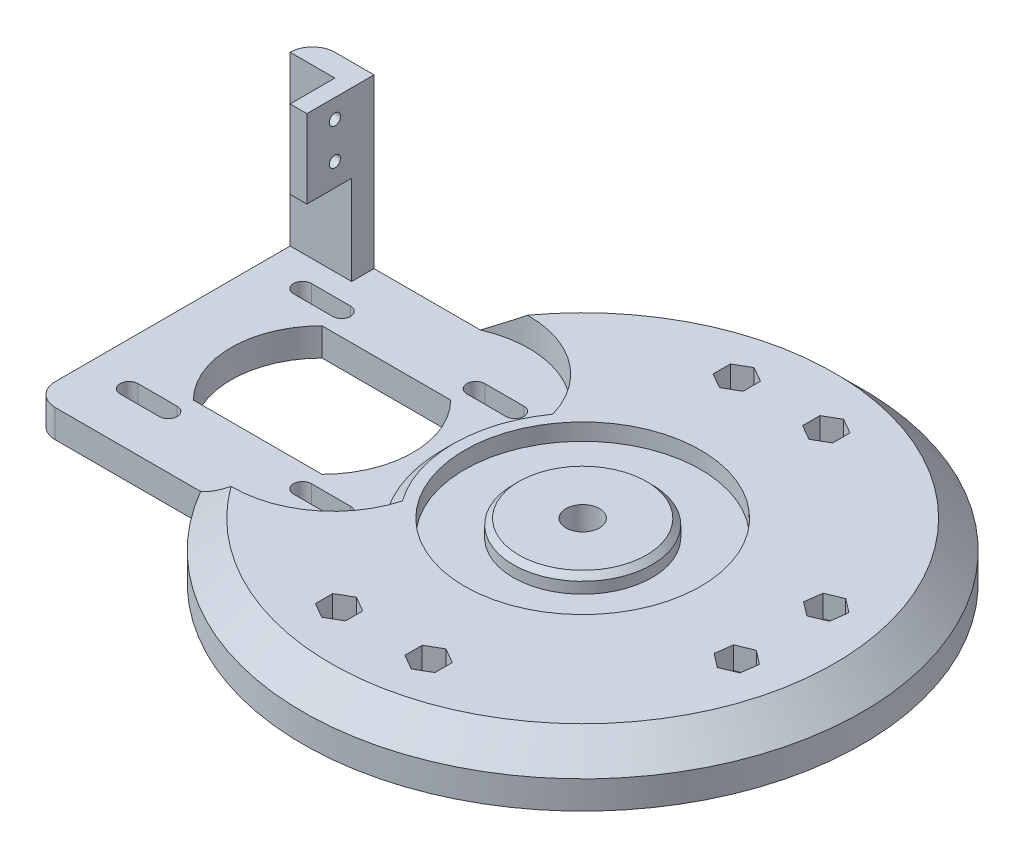
from build123d import *

# Parameters (mm, degrees)
SKETCH1_R            = 50
BOSS_EXTRUDE1_DEPTH  = 5
SKETCH2_R            = 25.1
SKETCH2_R_2          = 21.1
SKETCH2_R_3          = 12.4
SKETCH2_R_4          = 9.399999999999999
BOSS_EXTRUDE2_DEPTH  = 5
CHAMFER1_SIZE        = 1
CUT_EXTRUDE1_START   = -5
SKETCH3_R            = 9.399999999999997
CUT_EXTRUDE1_DEPTH   = 5
CUT_EXTRUDE2_DEPTH   = 5
BOSS_EXTRUDE3_DEPTH  = 5
SKETCH6_R            = 1.5000000000000009
SKETCH6_R_2          = 1.5000000000000018
SKETCH6_R_3          = 1.500000000000004
SKETCH6_R_4          = 1.5000000000000042
CUT_EXTRUDE3_DEPTH   = 10
CUT_EXTRUDE4_DEPTH   = 4
CHAMFER4_SIZE        = 2
SKETCH10_R           = 21.638560794932243
SKETCH10_R_2         = 12.399999999999999
BOSS_EXTRUDE4_DEPTH  = 2
CHAMFER5_SIZE        = 5
SKETCH14_R           = 9.399999999999995
SKETCH14_R_2         = 3
BOSS_EXTRUDE6_DEPTH  = 10
SKETCH16_R           = 9.4
CUT_EXTRUDE8_DEPTH   = 4
FILLET3_R            = 4
BOSS_EXTRUDE7_START  = 30
BOSS_EXTRUDE7_DEPTH  = 30
SKETCH22_W           = 12
SKETCH22_H           = 13.999999999999996
BOSS_EXTRUDE10_DEPTH = 3
SKETCH23_R           = 1.0000000000000018
CUT_EXTRUDE11_DEPTH  = 3
BOSS_EXTRUDE11_DEPTH = 4


with BuildPart() as part:
    # Sketch1 → Boss-Extrude1 (new body)
    with BuildSketch(Plane(origin=(0, 0, 0), x_dir=(1, 0, 0), z_dir=(0, 1, 0))):
        with BuildLine():
            ThreePointArc((-43.30127018922194, -24.999999999999986), (-50, 6.12e-15), (-43.30127018922194, 24.999999999999996))
            Line((-43.301270189221945, 24.99999999999999), (-73.30127018922194, 25.000000000000004))
            Line((-73.30127018922194, 25.000000000000004), (-73.30127018922195, -24.999999999999996))
            Line((-73.30127018922195, -24.999999999999996), (-43.30127018922194, -24.99999999999999))
        make_face()
        Circle(SKETCH1_R)
    extrude(amount=BOSS_EXTRUDE1_DEPTH)

    # Sketch2 → Boss-Extrude2 (add)
    # profile 1 of 2: a face of its own
    with BuildSketch(Plane(origin=(0, 5, 0), x_dir=(1, 0, 0), z_dir=(0, 1, 0))):
        with Locations(Location((0, 0, 0), (0, 0, 270))):
            Circle(SKETCH2_R)
        with Locations(Location((0, 0, 0), (0, 0, 270))):
            Circle(SKETCH2_R_2, mode=Mode.SUBTRACT)
    # profile 2 of 2: a face of its own
    with BuildSketch(Plane(origin=(0, 5, 0), x_dir=(1, 0, 0), z_dir=(0, 1, 0))):
        with Locations(Location((0, 0, 0), (0, 0, 270))):
            Circle(SKETCH2_R_3)
        with Locations(Location((0, 0, 0), (0, 0, 270))):
            Circle(SKETCH2_R_4, mode=Mode.SUBTRACT)
    extrude(amount=BOSS_EXTRUDE2_DEPTH)

    # Chamfer1
    chamfer1_edges = [part.edges().sort_by_distance(p)[0] for p in [
        (3.8e-15, 10, -12.4),
    ]]
    chamfer(chamfer1_edges, length=CHAMFER1_SIZE)

    # Sketch3 → Cut-Extrude1 (cut)
    with BuildSketch(Plane(origin=(0, 5, 0), x_dir=(1, 0, 0), z_dir=(0, 1, 0)).offset(CUT_EXTRUDE1_START)):
        with Locations(Location((0, 0, 0), (0, 0, 270))):
            Circle(SKETCH3_R)
    extrude(amount=CUT_EXTRUDE1_DEPTH, mode=Mode.SUBTRACT)

    # Sketch4 → Cut-Extrude2 (cut)
    with BuildSketch(Plane(origin=(0, 5, 0), x_dir=(1, 0, 0), z_dir=(0, 1, 0))):
        with BuildLine():
            Line((-65.60000000000008, 17.09999999999999), (-58.60000000000002, 17.099999999999994))
            ThreePointArc((-58.60000000000002, 17.099999999999994), (-57.000000000000014, 15.499999999999982), (-58.60000000000005, 13.899999999999999))
            Line((-58.60000000000005, 13.899999999999999), (-65.60000000000005, 13.899999999999995))
            ThreePointArc((-65.60000000000005, 13.899999999999995), (-67.20000000000007, 15.49999999999998), (-65.60000000000008, 17.09999999999999))
        make_face()
        with BuildLine():
            Line((-34.600000000000044, 17.099999999999998), (-27.599999999999948, 17.099999999999998))
            ThreePointArc((-27.599999999999948, 17.099999999999998), (-25.999999999999968, 15.499999999999998), (-27.59999999999995, 13.899999999999999))
            Line((-27.59999999999995, 13.899999999999999), (-34.600000000000044, 13.899999999999999))
            ThreePointArc((-34.600000000000044, 13.899999999999999), (-36.20000000000004, 15.499999999999998), (-34.600000000000044, 17.099999999999998))
        make_face()
        with BuildLine():
            Line((-34.600000000000044, -17.1), (-27.599999999999945, -17.099999999999998))
            ThreePointArc((-27.599999999999945, -17.099999999999998), (-25.999999999999964, -15.5), (-27.599999999999945, -13.899999999999997))
            Line((-27.599999999999945, -13.899999999999997), (-34.600000000000044, -13.899999999999999))
            ThreePointArc((-34.600000000000044, -13.899999999999999), (-36.20000000000003, -15.500000000000002), (-34.600000000000044, -17.1))
        make_face()
        with BuildLine():
            Line((-65.60000000000005, -17.1), (-58.600000000000016, -17.1))
            ThreePointArc((-58.600000000000016, -17.1), (-56.999999999999986, -15.500000000000005), (-58.600000000000016, -13.900000000000006))
            Line((-58.600000000000016, -13.900000000000006), (-65.60000000000005, -13.900000000000006))
            ThreePointArc((-65.60000000000005, -13.900000000000006), (-67.20000000000007, -15.500000000000005), (-65.60000000000005, -17.1))
        make_face()
        with BuildLine():
            Line((-58.10000000000014, 11.500000000000004), (-35.10000000000015, 11.500000000000004))
            ThreePointArc((-35.10000000000015, 11.500000000000004), (-30.336544032709547, -8.3e-16), (-35.10000000000015, -11.500000000000004))
            Line((-35.10000000000015, -11.500000000000004), (-58.10000000000014, -11.50000000000001))
            ThreePointArc((-58.10000000000014, -11.50000000000001), (-62.863455967290705, -6.4e-16), (-58.10000000000014, 11.500000000000004))
        make_face()
    extrude(amount=-CUT_EXTRUDE2_DEPTH, mode=Mode.SUBTRACT)

    # Sketch5 → Boss-Extrude3 (add)
    with BuildSketch(Plane(origin=(0, 5, 0), x_dir=(1, 0, 0), z_dir=(0, 1, 0))):
        with BuildLine():
            ThreePointArc((-43.30127018922194, -24.99999999999999), (50, 2.22e-14), (-43.301270189221945, 24.99999999999998))
            ThreePointArc((-43.301270189221945, 24.99999999999998), (-29.51879380479877, 25.25375244111435), (-19.593681219974982, 15.68749999999999))
            ThreePointArc((-19.593681219974982, 15.68749999999999), (25.099999999999998, 0), (-19.593681219974982, -15.68749999999999))
            ThreePointArc((-19.593681219974982, -15.68749999999999), (-29.518793804798747, -25.253752441114404), (-43.30127018922194, -24.99999999999999))
        make_face()
    extrude(amount=BOSS_EXTRUDE3_DEPTH)

    # Sketch6 → Cut-Extrude3 (cut)
    with BuildSketch(Plane(origin=(0, 10, 0), x_dir=(1, 0, 0), z_dir=(0, 1, 0))):
        with Locations(Location((8.000000000000004, -35.55, 0), (0, 0, 270))):
            Circle(SKETCH6_R)
        with Locations(Location((-8, -35.55, 0), (0, 0, 90))):
            Circle(SKETCH6_R_2)
        with Locations(Location((8.000000000000004, 35.55, 0), (0, 0, 90))):
            Circle(SKETCH6_R)
        with Locations(Location((-8, 35.55, 0), (0, 0, 270))):
            Circle(SKETCH6_R_2)
        with Locations(Location((35.55, -8, 0), (0, 0, 270))):
            Circle(SKETCH6_R_3)
        with Locations(Location((35.55, 8, 0), (0, 0, 90))):
            Circle(SKETCH6_R_4)
    extrude(amount=-CUT_EXTRUDE3_DEPTH, mode=Mode.SUBTRACT)

    # Sketch7 → Cut-Extrude4 (cut)
    with BuildSketch(Plane(origin=(0, 10, 0), x_dir=(1, 0, 0), z_dir=(0, 1, 0))):
        Polygon((-7.9999999999999964, -38.650000000000006), (-5.315321248268234, -37.1), (-5.315321248268235, -34), (-7.9999999999999964, -32.45000000000001), (-10.684678751731763, -34.00000000000001), (-10.684678751731763, -37.1), align=None)
        Polygon((8.000000000000005, -38.650000000000006), (10.684678751731774, -37.099999999999994), (10.684678751731772, -33.999999999999986), (8.00000000000001, -32.449999999999996), (5.315321248268237, -34), (5.315321248268238, -37.099999999999994), align=None)
        Polygon((5.315321248268238, 37.099999999999994), (8.000000000000005, 38.650000000000006), (10.684678751731774, 37.099999999999994), (10.684678751731772, 33.999999999999986), (8.00000000000001, 32.449999999999996), (5.315321248268237, 34), align=None)
        Polygon((-10.684678751731763, 37.1), (-7.9999999999999964, 38.650000000000006), (-5.315321248268234, 37.1), (-5.315321248268235, 34), (-7.9999999999999964, 32.45000000000001), (-10.684678751731763, 34.00000000000001), align=None)
        Polygon((32.68508267298749, 6.815834171501503), (35.1430590262669, 4.926825900815709), (38.00797635327939, 6.110991729314209), (38.4149173270125, 9.184165828498493), (35.956940973733104, 11.073174099184284), (33.0920236467206, 9.88900827068578), align=None)
        Polygon((32.68365214703024, -9.180698939516597), (35.13934134935783, -11.072679526513099), (38.005689202327595, -9.891980586996501), (38.416347852969764, -6.819301060483406), (35.96065865064216, -4.927320473486905), (33.0943107976724, -6.108019413003499), align=None)
    extrude(amount=-CUT_EXTRUDE4_DEPTH, mode=Mode.SUBTRACT)

    # Chamfer4
    chamfer4_edges = [part.edges().sort_by_distance(p)[0] for p in [
        (-25.1, 10, -9.22e-15),
    ]]
    chamfer(chamfer4_edges, length=CHAMFER4_SIZE)

    # Sketch10 → Boss-Extrude4 (add)
    with BuildSketch(Plane(origin=(0, 5, 0), x_dir=(1, 0, 0), z_dir=(0, 1, 0))):
        Circle(SKETCH10_R)
        with Locations(Location((0, 0, 0), (0, 0, 270))):
            Circle(SKETCH10_R_2, mode=Mode.SUBTRACT)
    extrude(amount=BOSS_EXTRUDE4_DEPTH)

    # Chamfer5
    chamfer5_edges = [part.edges().sort_by_distance(p)[0] for p in [
        (50.00000000000001, 10, -2.487e-14),
    ]]
    chamfer(chamfer5_edges, length=CHAMFER5_SIZE)

    # Sketch14 → Boss-Extrude6 (add)
    with BuildSketch(Plane.XZ):
        Circle(SKETCH14_R)
        with Locations(Location((0, 0, 0), (0, 0, 90))):
            Circle(SKETCH14_R_2, mode=Mode.SUBTRACT)
    extrude(amount=-BOSS_EXTRUDE6_DEPTH)

    # Sketch16 → Cut-Extrude8 (cut)
    with BuildSketch(Plane.XZ):
        with Locations(Location((0, 0, 0), (0, 0, 270))):
            Circle(SKETCH16_R)
    extrude(amount=-CUT_EXTRUDE8_DEPTH, mode=Mode.SUBTRACT)

    # Fillet3
    fillet3_edges = [part.edges().sort_by_distance(p)[0] for p in [
        (-73.30127018922195, 2.5, 24.999999999999996),
        (-73.30127018922194, 2.5, -25.000000000000004),
    ]]
    fillet(fillet3_edges, radius=FILLET3_R)

    # Sketch17 → Boss-Extrude7 (add)
    with BuildSketch(Plane(origin=(0, 5, 0), x_dir=(1, 0, 0), z_dir=(0, 1, 0)).offset(BOSS_EXTRUDE7_START)):
        with BuildLine():
            Line((-65.30127018922194, 24.999999999999968), (-65.30127018922194, 21.000000000000004))
            Line((-65.30127018922194, 21.000000000000004), (-73.30127018922195, 21))
            ThreePointArc((-73.30127018922195, 21), (-72.12969731396817, 23.82842712474621), (-69.30127018922194, 24.999999999999968))
            Line((-69.30127018922194, 24.999999999999968), (-65.30127018922194, 24.999999999999968))
        make_face()
    extrude(amount=-BOSS_EXTRUDE7_DEPTH)

    # Sketch22 → Boss-Extrude10 (add)
    with BuildSketch(Plane(origin=(-65.30127018922194, 0, 0), x_dir=(0, 0, -1), z_dir=(1, 0, 0))):
        with Locations((18.999999999999964, 27.999999999999993)):
            Rectangle(SKETCH22_W, SKETCH22_H)
    extrude(amount=BOSS_EXTRUDE10_DEPTH)

    # Sketch23 → Cut-Extrude11 (cut)
    with BuildSketch(Plane.ZY.offset(65.30127018922194)):
        with Locations((-17.999999999999968, 31.599999999999998)):
            Circle(SKETCH23_R)
        with Locations((-17.999999999999968, 25.089999999999993)):
            Circle(SKETCH23_R)
    extrude(amount=-CUT_EXTRUDE11_DEPTH, mode=Mode.SUBTRACT)

    # Sketch24 → Boss-Extrude11 (add)
    with BuildSketch(Plane(origin=(1.156e-14, 0, -24.99999999999997), x_dir=(-1, 0, -4.6e-16), z_dir=(4.6e-16, 0, -1))):
        Polygon((62.30127018922195, 20.999999999999996), (62.30127018922195, 5.000000000000001), (65.30127018922195, 5), (65.30127018922195, 20.999999999999996), align=None)
    extrude(amount=-BOSS_EXTRUDE11_DEPTH)


solid = part.part
